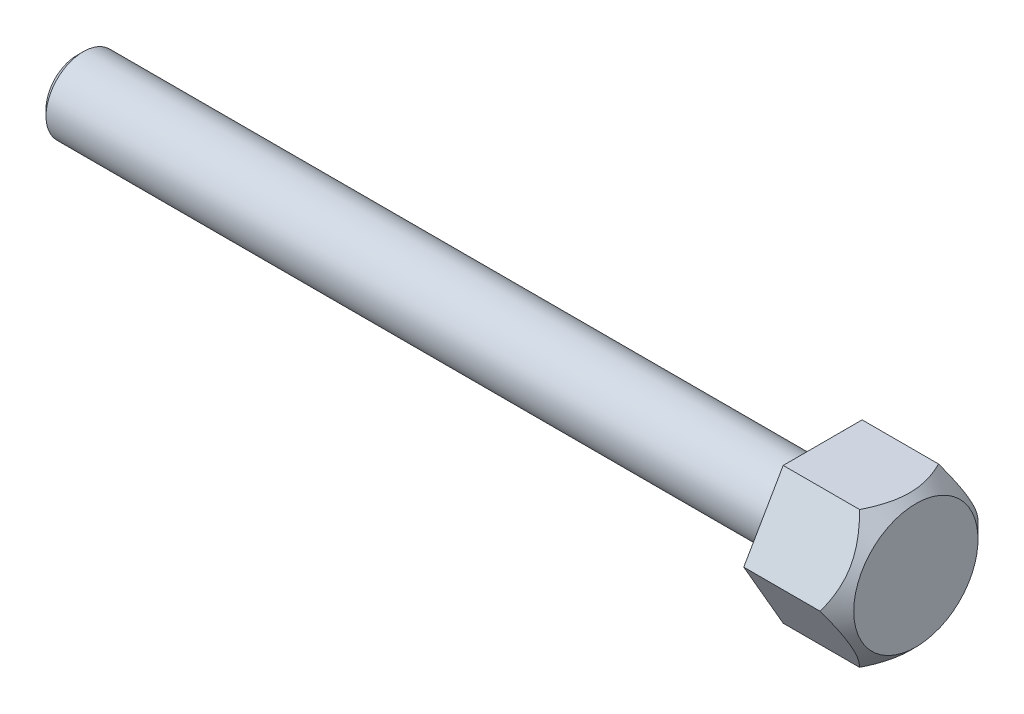
from build123d import *

# Parameters (mm, degrees)
BOSS_EXTRUDE1_DEPTH = 3.75


with BuildPart() as part:
    # Sketch1 → Revolve1 (revolve)
    with BuildSketch(Plane.XY, mode=Mode.PRIVATE) as revolve1_sk:
        Polygon((0, 0), (0, 1.5), (-29.75, 1.5), (-30, 1.25), (-30, 0), align=None)
    revolve(revolve1_sk.sketch.rotate(Axis((-30, 0, 0), (1, 0, 0)), 90), axis=Axis((-30, 0, 0), (1, 0, 0)))

    # Sketch2 → Boss-Extrude1 (add)
    with BuildSketch(Plane(origin=(0, 0, 0), x_dir=(0, 0, -1), z_dir=(1, 0, 0))):
        Polygon((-1.58771324, 2.75), (0, 2.75), (1.58771324, 2.75), (2.38156986, 1.375), (3.175426481, 0), (2.38156986, -1.375), (1.58771324, -2.75), (0, -2.75), (-1.58771324, -2.75), (-2.38156986, -1.375), (-3.175426481, 0), (-2.38156986, 1.375), align=None)
    extrude(amount=BOSS_EXTRUDE1_DEPTH)

    # Sketch3 → Cut-Revolve3 (revolve, cut)
    with BuildSketch(Plane.XY, mode=Mode.PRIVATE) as cut_revolve3_sk:
        Polygon((4, -2.25), (3.5, -2.75), (2.25, -4), (5.25, -4), (5.25, -1), align=None)
    revolve(cut_revolve3_sk.sketch.rotate(Axis((0, 0, 0), (1, 0, 0)), 270), axis=Axis((0, 0, 0), (1, 0, 0)), mode=Mode.SUBTRACT)


solid = part.part
